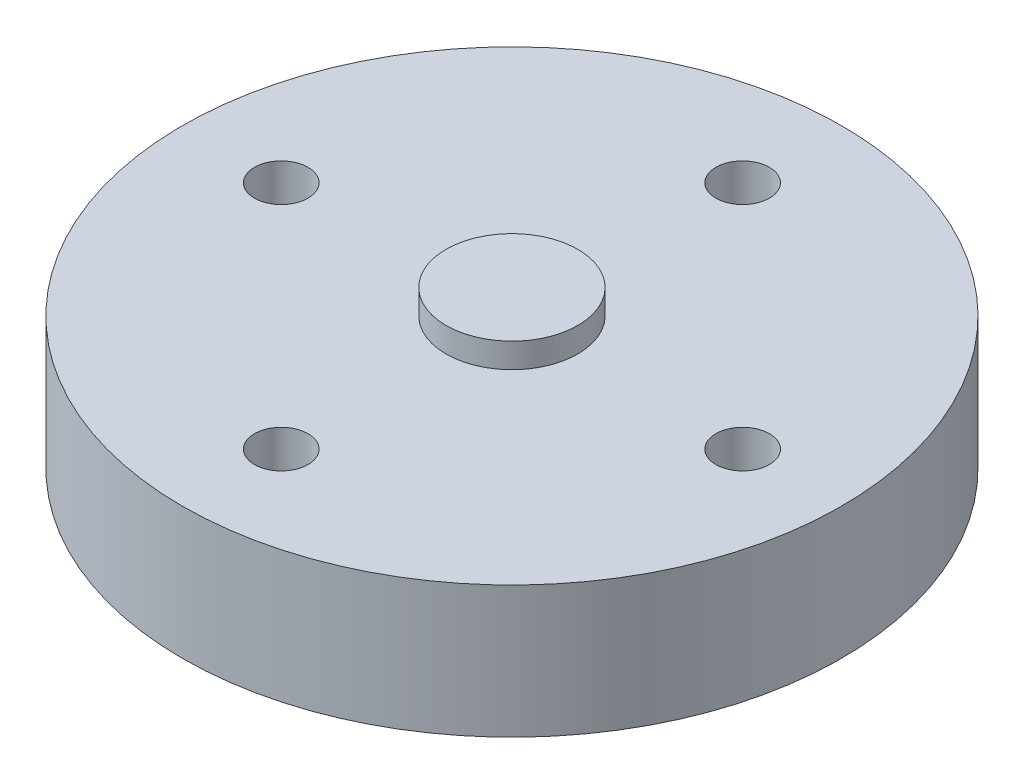
from build123d import *

# Parameters (mm, degrees)
CROQUIS3_R              = 20
SALIENTE_EXTRUIR1_DEPTH = 8
SALIENTE_EXTRUIR3_START = 8
CROQUIS4_R              = 4
SALIENTE_EXTRUIR3_DEPTH = 1.5
CROQUIS7_R              = 1.625
CORTAR_EXTRUIR2_DEPTH   = 30.393876913


with BuildPart() as part:
    # Croquis3 → Saliente-Extruir1 (new body)
    with BuildSketch(Plane(origin=(0, 0, 0), x_dir=(1, 0, 0), z_dir=(0, 1, 0))):
        with Locations(Location((0, 0, 0), (0, 0, 270))):
            Circle(CROQUIS3_R)
    extrude(amount=SALIENTE_EXTRUIR1_DEPTH)

    # Croquis4 → Saliente-Extruir3 (add)
    with BuildSketch(Plane(origin=(0, 0, 0), x_dir=(1, 0, 0), z_dir=(0, 1, 0)).offset(SALIENTE_EXTRUIR3_START)):
        with Locations(Location((0, 0, 0), (0, 0, 270))):
            Circle(CROQUIS4_R)
    extrude(amount=SALIENTE_EXTRUIR3_DEPTH)

    # Croquis7 → Cortar-Extruir2 (cut, through all)
    with BuildSketch(Plane(origin=(0, 8, 0), x_dir=(1, 0, 0), z_dir=(0, 1, 0))):
        with Locations(Location((-14, 0, 0), (0, 0, 270))):
            Circle(CROQUIS7_R)
        with Locations(Location((14, 0, 0), (0, 0, 270))):
            Circle(CROQUIS7_R)
        with Locations(Location((0, 14, 0), (0, 0, 270))):
            Circle(CROQUIS7_R)
        with Locations(Location((0, -14, 0), (0, 0, 270))):
            Circle(CROQUIS7_R)
    extrude(amount=-CORTAR_EXTRUIR2_DEPTH, mode=Mode.SUBTRACT)


solid = part.part
